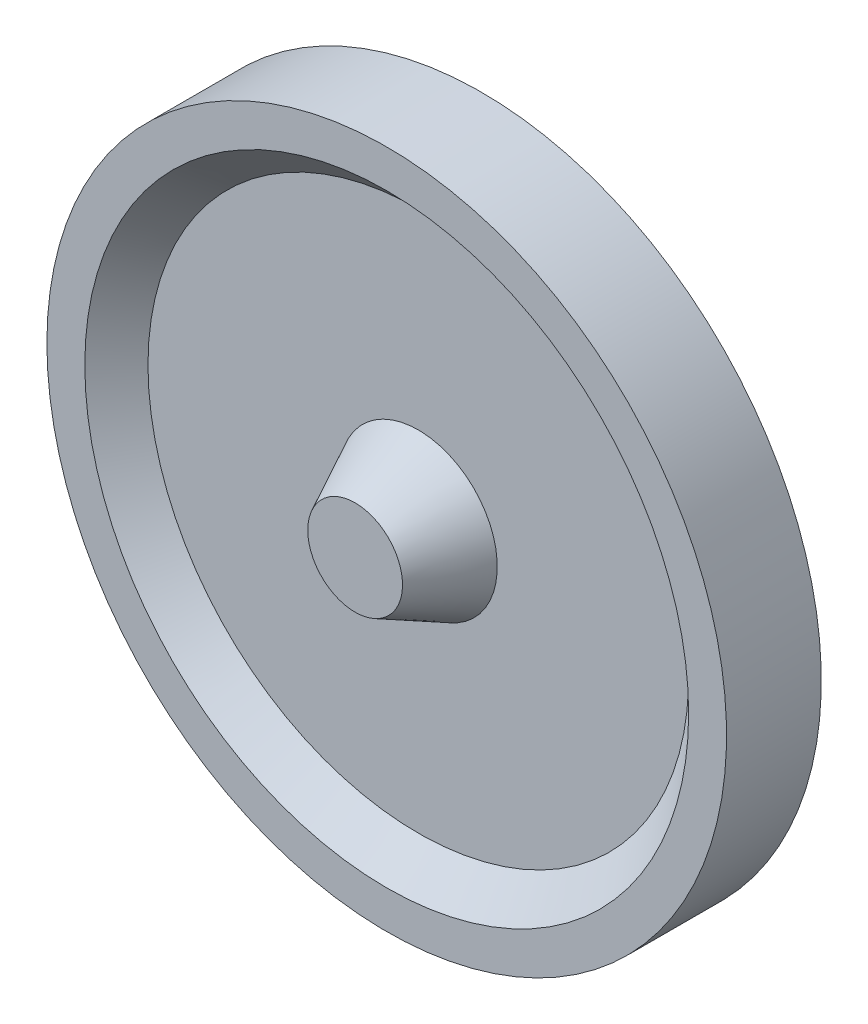
from build123d import *


with BuildPart() as part:
    # Sketch3 → Revolve1 (revolve)
    with BuildSketch(Plane(origin=(0, 0, 0), x_dir=(1, 0, 0), z_dir=(0, 1, 0)), mode=Mode.PRIVATE) as revolve1_sk:
        Polygon((17.119809747, 1), (19.119809747, 3), (21.521061255, 3), (21.521061255, -3), (19.119809747, -3), (17.119809747, -1), (5, -1), (3, -5), (0, -5), (0, 5), (3, 5), (5, 1), align=None)
    revolve(revolve1_sk.sketch.rotate(Axis((0, 0, -9.992775867), (0, 0, 1)), 180), axis=Axis((0, 0, -9.992775867), (0, 0, 1)))


solid = part.part
